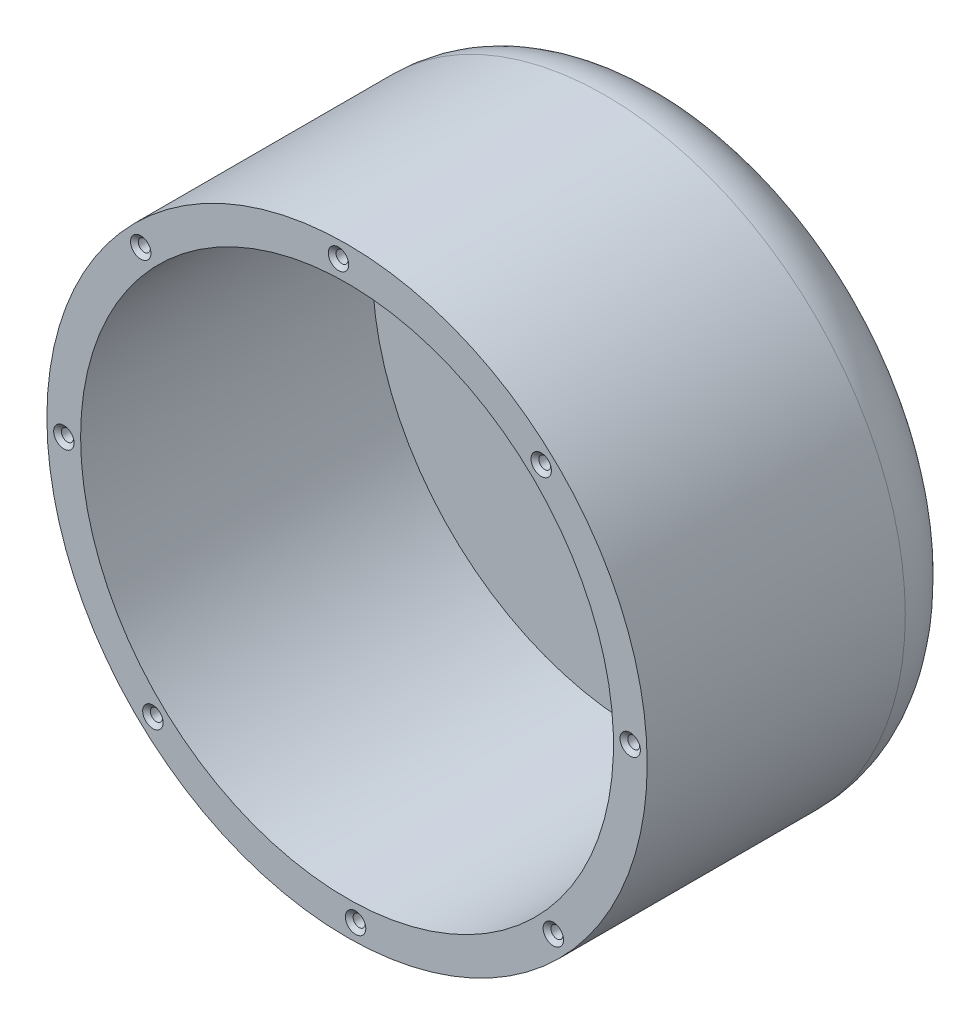
from build123d import *

# Parameters (mm, degrees)
SKETCH1_R                                 = 44.5
BOSS_EXTRUDE1_DEPTH                       = 24.13
SHELL1_T                                  = -5
CSK_FOR_0_FLAT_HEAD_MACHINE_SCREW_2_COUNT = 2
CSK_FOR_0_FLAT_HEAD_MACHINE_SCREW_2_PITCH = 69.412105808
CIRPATTERN1_COUNT                         = 8
FILLET1_R                                 = 10


with BuildPart() as part:
    # Sketch1 → Boss-Extrude1 (new, symmetric)
    with BuildSketch(Plane.XY):
        with Locations(Location((0, 0, 0), (0, 0, 180))):
            Circle(SKETCH1_R)
    extrude(amount=BOSS_EXTRUDE1_DEPTH, both=True)

    # Shell1
    shell1_openings = [part.faces().sort_by_distance(p)[0] for p in [
        (0, 0, 24.13),
    ]]
    offset(amount=SHELL1_T, openings=shell1_openings, kind=Kind.INTERSECTION)

    # Sketch5 → CSK for #0 Flat Head Machine Screw (100)1 (revolve, cut)
    with BuildSketch(Plane(origin=(-1.269301035, 41.980815558, 24.13), x_dir=(0, -1, 0), z_dir=(1, 0, 0))):
        Polygon((0, 0), (0, 3.07416509), (0.889, 2.54), (0.889, 0.5221717), (1.5113, 0), align=None)
    csk_for_0_flat_head_machine_screw_100 = revolve(axis=Axis((-1.269301035, 41.980815558, 30.48), (0, 0, -1)), mode=Mode.SUBTRACT)

    # CSK for _0 Flat Head Machine Screw _ 2: CSK for #0 Flat Head Machine Screw (100)1 ×2
    with Locations(*[Vector(0.9567328467758284, -0.2909677987341887, 0) * (i * CSK_FOR_0_FLAT_HEAD_MACHINE_SCREW_2_PITCH) for i in range(1, CSK_FOR_0_FLAT_HEAD_MACHINE_SCREW_2_COUNT)]):
        add(csk_for_0_flat_head_machine_screw_100, mode=Mode.SUBTRACT)

    # CirPattern1: CSK for #0 Flat Head Machine Screw (100)1 ×8 about axis
    cirpattern1_axis = Axis((0, 0, 0), (0, 0, 1))
    for i in range(1, CIRPATTERN1_COUNT):
        add(csk_for_0_flat_head_machine_screw_100.rotate(cirpattern1_axis, i * 360 / CIRPATTERN1_COUNT), mode=Mode.SUBTRACT)

    # CirPattern1 copy 1 sketch → CirPattern1 copy 1 (revolve, cut)
    with BuildSketch(Plane(origin=(30.656906272, 61.464315428, 24.13), x_dir=(0.7071067811865475, -0.7071067811865476, 0), z_dir=(0.7071067811865476, 0.7071067811865475, 0))):
        Polygon((0, 0), (0, 3.07416509), (0.889, 2.54), (0.889, 0.5221717), (1.5113, 0), align=None)
    revolve(axis=Axis((30.656906272, 61.464315428, 30.48), (0, 0, -1)), mode=Mode.SUBTRACT)

    # CirPattern1 copy 2 sketch → CirPattern1 copy 2 (revolve, cut)
    with BuildSketch(Plane(origin=(-21.784127925, 65.139540555, 24.13), x_dir=(1, 0, 0), z_dir=(0, 1, 0))):
        Polygon((0, 0), (0, 3.07416509), (0.889, 2.54), (0.889, 0.5221717), (1.5113, 0), align=None)
    revolve(axis=Axis((-21.784127925, 65.139540555, 30.48), (0, 0, -1)), mode=Mode.SUBTRACT)

    # CirPattern1 copy 3 sketch → CirPattern1 copy 3 (revolve, cut)
    with BuildSketch(Plane(origin=(-61.464315428, 30.656906272, 24.13), x_dir=(0.7071067811865476, 0.7071067811865475, 0), z_dir=(-0.7071067811865475, 0.7071067811865476, 0))):
        Polygon((0, 0), (0, 3.07416509), (0.889, 2.54), (0.889, 0.5221717), (1.5113, 0), align=None)
    revolve(axis=Axis((-61.464315428, 30.656906272, 30.48), (0, 0, -1)), mode=Mode.SUBTRACT)

    # CirPattern1 copy 4 sketch → CirPattern1 copy 4 (revolve, cut)
    with BuildSketch(Plane(origin=(-65.139540555, -21.784127925, 24.13), x_dir=(0, 1, 0), z_dir=(-1, 0, 0))):
        Polygon((0, 0), (0, 3.07416509), (0.889, 2.54), (0.889, 0.5221717), (1.5113, 0), align=None)
    revolve(axis=Axis((-65.139540555, -21.784127925, 30.48), (0, 0, -1)), mode=Mode.SUBTRACT)

    # CirPattern1 copy 5 sketch → CirPattern1 copy 5 (revolve, cut)
    with BuildSketch(Plane(origin=(-30.656906272, -61.464315428, 24.13), x_dir=(-0.7071067811865475, 0.7071067811865477, 0), z_dir=(-0.7071067811865477, -0.7071067811865475, 0))):
        Polygon((0, 0), (0, 3.07416509), (0.889, 2.54), (0.889, 0.5221717), (1.5113, 0), align=None)
    revolve(axis=Axis((-30.656906272, -61.464315428, 30.48), (0, 0, -1)), mode=Mode.SUBTRACT)

    # CirPattern1 copy 6 sketch → CirPattern1 copy 6 (revolve, cut)
    with BuildSketch(Plane(origin=(21.784127925, -65.139540555, 24.13), x_dir=(-1, 0, 0), z_dir=(0, -1, 0))):
        Polygon((0, 0), (0, 3.07416509), (0.889, 2.54), (0.889, 0.5221717), (1.5113, 0), align=None)
    revolve(axis=Axis((21.784127925, -65.139540555, 30.48), (0, 0, -1)), mode=Mode.SUBTRACT)

    # CirPattern1 copy 7 sketch → CirPattern1 copy 7 (revolve, cut)
    with BuildSketch(Plane(origin=(61.464315428, -30.656906272, 24.13), x_dir=(-0.7071067811865477, -0.7071067811865474, 0), z_dir=(0.7071067811865474, -0.7071067811865477, 0))):
        Polygon((0, 0), (0, 3.07416509), (0.889, 2.54), (0.889, 0.5221717), (1.5113, 0), align=None)
    revolve(axis=Axis((61.464315428, -30.656906272, 30.48), (0, 0, -1)), mode=Mode.SUBTRACT)

    # Fillet1
    fillet1_edges = [part.edges().sort_by_distance(p)[0] for p in [
        (44.5, 0, -24.13),
    ]]
    fillet(fillet1_edges, radius=FILLET1_R)


solid = part.part
